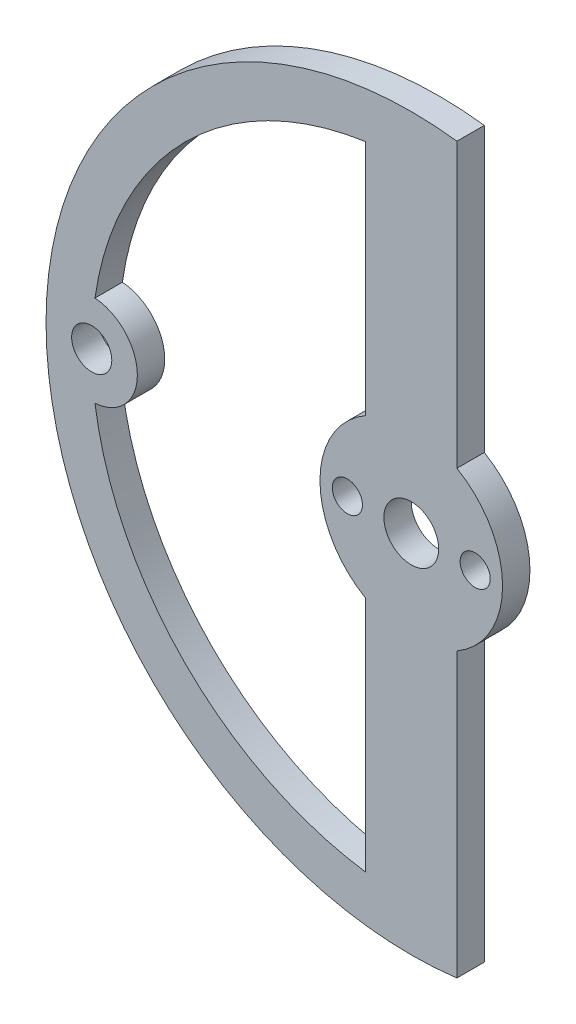
from build123d import *

# Parameters (mm, degrees)
SKETCH1_R           = 40
SKETCH1_R_2         = 3
SKETCH1_R_3         = 1.65
SKETCH1_R_4         = 2.2
BOSS_EXTRUDE1_DEPTH = 3
CUT_EXTRUDE1_DEPTH  = 10


with BuildPart() as part:
    # Sketch1 → Boss-Extrude1 (new body)
    with BuildSketch(Plane.XY):
        Circle(SKETCH1_R)
        with BuildLine():
            Line((5, -34.641016151), (5, -8.660254038))
            ThreePointArc((5, -8.660254038), (10, 0), (5, 8.660254038))
            Line((5, 8.660254038), (5, 34.641016151))
            ThreePointArc((5, 34.641016151), (35, 0), (5, -34.641016151))
        make_face(mode=Mode.SUBTRACT)
        with BuildLine():
            Line((-5, 34.641016151), (-5, 8.660254038))
            ThreePointArc((-5, 8.660254038), (-10, 0), (-5, -8.660254038))
            Line((-5, -8.660254038), (-5, -34.641016151))
            ThreePointArc((-5, -34.641016151), (-24.753298969, -24.744174873), (-34.642857143, -4.987228587))
            ThreePointArc((-34.642857143, -4.987228587), (-30, 0), (-34.642857143, 4.987228587))
            ThreePointArc((-34.642857143, 4.987228587), (-24.753298969, 24.744174873), (-5, 34.641016151))
        make_face(mode=Mode.SUBTRACT)
        Circle(SKETCH1_R_2, mode=Mode.SUBTRACT)
        with Locations((-7, 0)):
            Circle(SKETCH1_R_3, mode=Mode.SUBTRACT)
        with Locations((7, 0)):
            Circle(SKETCH1_R_3, mode=Mode.SUBTRACT)
        with Locations((-35, 0)):
            Circle(SKETCH1_R_4, mode=Mode.SUBTRACT)
    extrude(amount=BOSS_EXTRUDE1_DEPTH)

    # Sketch3 → Cut-Extrude1 (cut)
    with BuildSketch(Plane.XY.offset(3)):
        Polygon((5, 39.686269666), (5, 8.660254038), (14.289111203, 8.660254038), (14.289111203, -8.660254038), (5, -8.660254038), (5, -39.686269666), (45, -39.686269666), (45, 39.686269666), align=None)
    extrude(amount=-CUT_EXTRUDE1_DEPTH, mode=Mode.SUBTRACT)


solid = part.part
